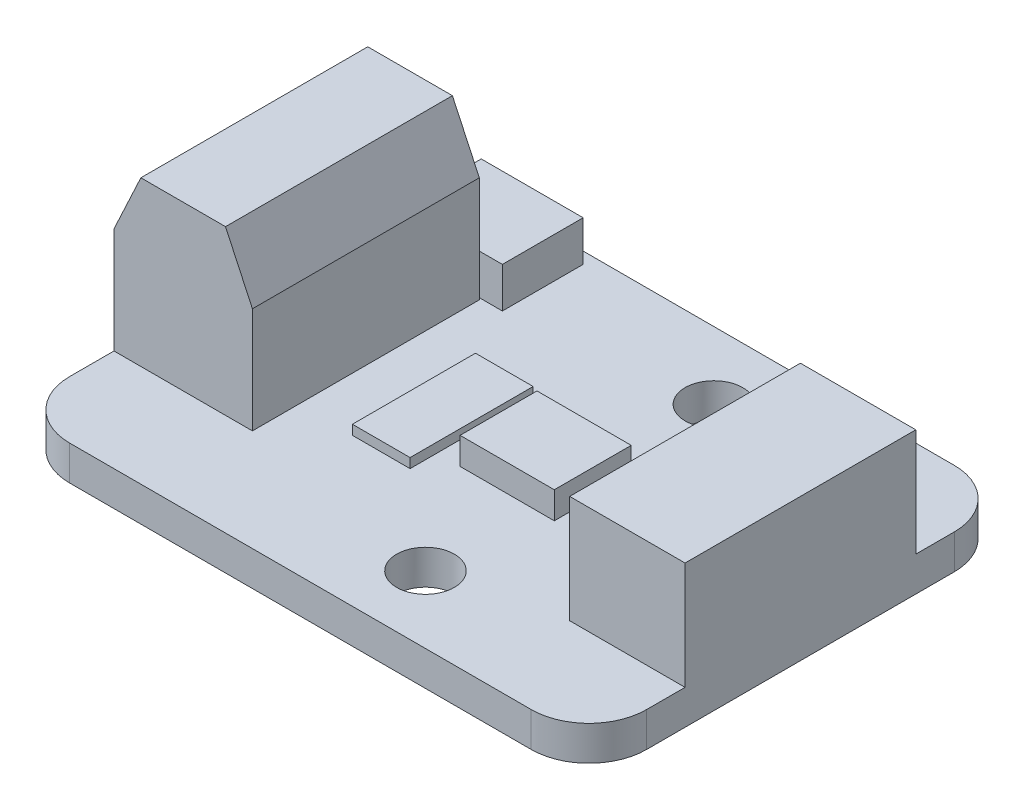
from build123d import *
from OCP.BRepFilletAPI import BRepFilletAPI_MakeChamfer

# Parameters (mm, degrees)
SKETCH1_W           = 30
SKETCH1_H           = 22
BOSS_EXTRUDE1_DEPTH = 1.8
SKETCH2_R           = 1.5
CUT_EXTRUDE1_DEPTH  = 1.8
SKETCH3_W           = 7.2
SKETCH3_H           = 11.8
BOSS_EXTRUDE2_DEPTH = 8.5
SKETCH4_W           = 6
SKETCH4_H           = 12
BOSS_EXTRUDE3_DEPTH = 5.6
SKETCH5_W           = 5.3
SKETCH5_H           = 4.2
BOSS_EXTRUDE4_DEPTH = 2.1
SKETCH6_W           = 4.9
SKETCH6_H           = 4
BOSS_EXTRUDE5_DEPTH = 1.4
SKETCH7_W           = 3
SKETCH7_H           = 6.4
BOSS_EXTRUDE6_DEPTH = 0.5
FILLET1_R           = 3
CHAMFER1_SIZE       = 3
CHAMFER1_SIZE2      = 1.398922974


with BuildPart() as part:
    # Sketch1 → Boss-Extrude1 (new body)
    with BuildSketch(Plane(origin=(0, 0, 0), x_dir=(1, 0, 0), z_dir=(0, 1, 0))):
        with Locations((15, 11)):
            Rectangle(SKETCH1_W, SKETCH1_H)
    extrude(amount=BOSS_EXTRUDE1_DEPTH)

    # Sketch2 → Cut-Extrude1 (cut)
    with BuildSketch(Plane(origin=(0, 1.8, 0), x_dir=(1, 0, 0), z_dir=(0, 1, 0))):
        with Locations(Location((18, 18.5, 0), (0, 0, 270))):
            Circle(SKETCH2_R)
        with Locations(Location((18, 3.5, 0), (0, 0, 270))):
            Circle(SKETCH2_R)
    extrude(amount=-CUT_EXTRUDE1_DEPTH, mode=Mode.SUBTRACT)

    # Sketch3 → Boss-Extrude2 (add)
    with BuildSketch(Plane(origin=(0, 1.8, 0), x_dir=(1, 0, 0), z_dir=(0, 1, 0))):
        with Locations((3.6, 11.2)):
            Rectangle(SKETCH3_W, SKETCH3_H)
    extrude(amount=BOSS_EXTRUDE2_DEPTH)

    # Sketch4 → Boss-Extrude3 (add)
    with BuildSketch(Plane(origin=(0, 1.8, 0), x_dir=(1, 0, 0), z_dir=(0, 1, 0))):
        with Locations((27, 11)):
            Rectangle(SKETCH4_W, SKETCH4_H)
    extrude(amount=BOSS_EXTRUDE3_DEPTH)

    # Sketch5 → Boss-Extrude4 (add)
    with BuildSketch(Plane(origin=(0, 1.8, 0), x_dir=(1, 0, 0), z_dir=(0, 1, 0))):
        with Locations((5.65, 19.3)):
            Rectangle(SKETCH5_W, SKETCH5_H)
    extrude(amount=BOSS_EXTRUDE4_DEPTH)

    # Sketch6 → Boss-Extrude5 (add)
    with BuildSketch(Plane(origin=(0, 1.8, 0), x_dir=(1, 0, 0), z_dir=(0, 1, 0))):
        with Locations((16.65, 11.1)):
            Rectangle(SKETCH6_W, SKETCH6_H)
    extrude(amount=BOSS_EXTRUDE5_DEPTH)

    # Sketch7 → Boss-Extrude6 (add)
    with BuildSketch(Plane(origin=(0, 1.8, 0), x_dir=(1, 0, 0), z_dir=(0, 1, 0))):
        with Locations((11.5, 10.9)):
            Rectangle(SKETCH7_W, SKETCH7_H)
    extrude(amount=BOSS_EXTRUDE6_DEPTH)

    # Fillet1
    fillet1_edges = [part.edges().sort_by_distance(p)[0] for p in [
        (0, 0.9, -22),
        (30, 0.9, -22),
        (30, 0.9, 0),
        (0, 0.9, 0),
    ]]
    fillet(fillet1_edges, radius=FILLET1_R)

    # Chamfer1: one chamfer whose edges measure the first distance from different faces: ONE call of the kernel's chamfer builder (chamfer() names one face for all edges)
    chamfer1_edges_1 = [part.edges().sort_by_distance(p)[0] for p in [
        (0, 10.3, -11.2),
    ]]
    chamfer1_side_1 = [part.faces().sort_by_distance(p)[0] for p in [
        (0, 4.90112316, -11.155383424),
    ]]
    chamfer1_edges_2 = [part.edges().sort_by_distance(p)[0] for p in [
        (7.2, 10.3, -11.2),
    ]]
    chamfer1_side_2 = [part.faces().sort_by_distance(p)[0] for p in [
        (7.2, 6.05, -11.2),
    ]]
    chamfer1 = BRepFilletAPI_MakeChamfer(part.part.solid().wrapped)
    for e in chamfer1_edges_1:
        chamfer1.Add(CHAMFER1_SIZE, CHAMFER1_SIZE2, e.wrapped, chamfer1_side_1[0].wrapped)  # the first distance lies on this face
    for e in chamfer1_edges_2:
        chamfer1.Add(CHAMFER1_SIZE, CHAMFER1_SIZE2, e.wrapped, chamfer1_side_2[0].wrapped)  # the first distance lies on this face
    add(Compound.cast(chamfer1.Shape()), mode=Mode.REPLACE)


solid = part.part
